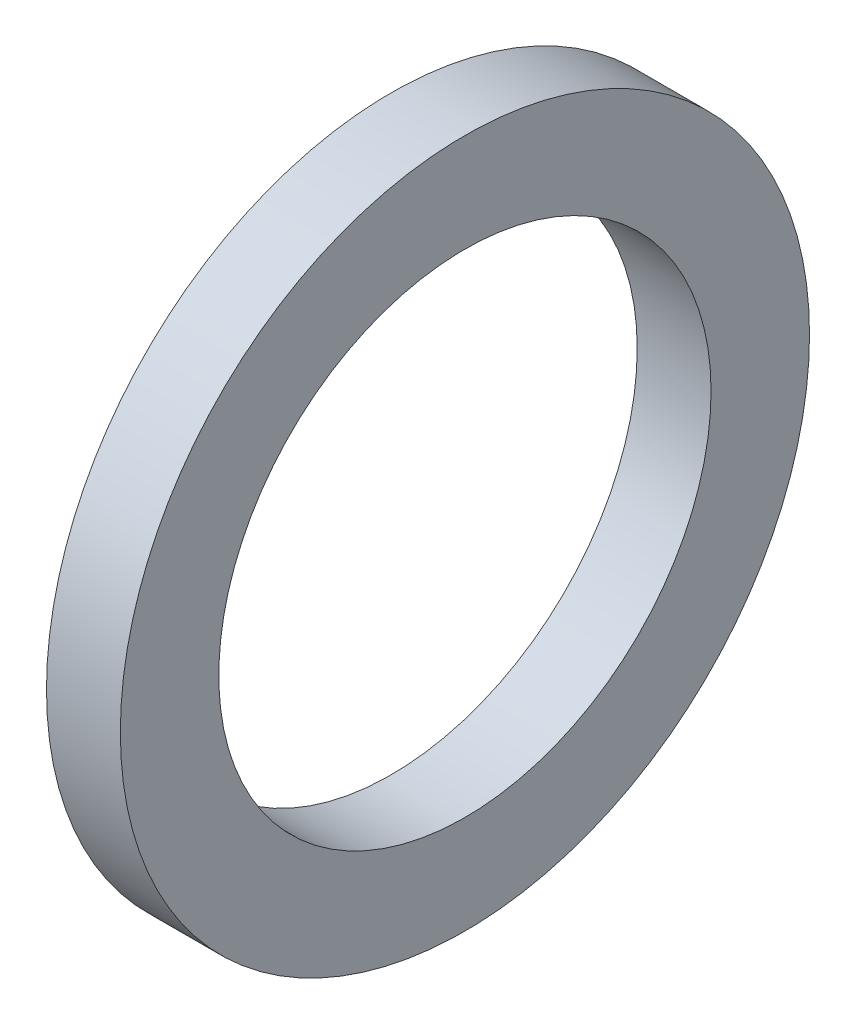
from build123d import *

# Parameters (mm, degrees)
SKETCH1_R           = 14
SKETCH1_R_2         = 10
BOSS_EXTRUDE1_DEPTH = 3


with BuildPart() as part:
    # Sketch1 → Boss-Extrude1 (new body)
    with BuildSketch(Plane(origin=(0, 0, 0), x_dir=(0, 0, -1), z_dir=(1, 0, 0))):
        Circle(SKETCH1_R)
        Circle(SKETCH1_R_2, mode=Mode.SUBTRACT)
    extrude(amount=BOSS_EXTRUDE1_DEPTH)


solid = part.part
